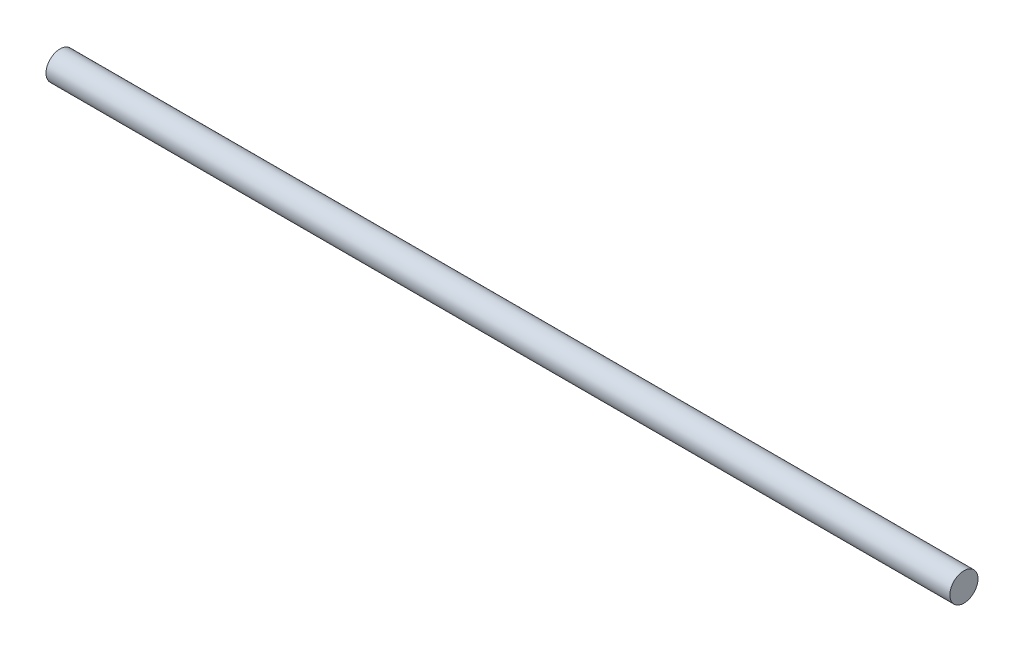
from build123d import *

# Parameters (mm, degrees)
SKETCH1_R           = 5
BOSS_EXTRUDE1_DEPTH = 160.5


with BuildPart() as part:
    # Sketch1 → Boss-Extrude1 (new, symmetric)
    with BuildSketch(Plane(origin=(0, 0, 0), x_dir=(0, 0, -1), z_dir=(1, 0, 0))):
        Circle(SKETCH1_R)
    extrude(amount=BOSS_EXTRUDE1_DEPTH, both=True)


solid = part.part
